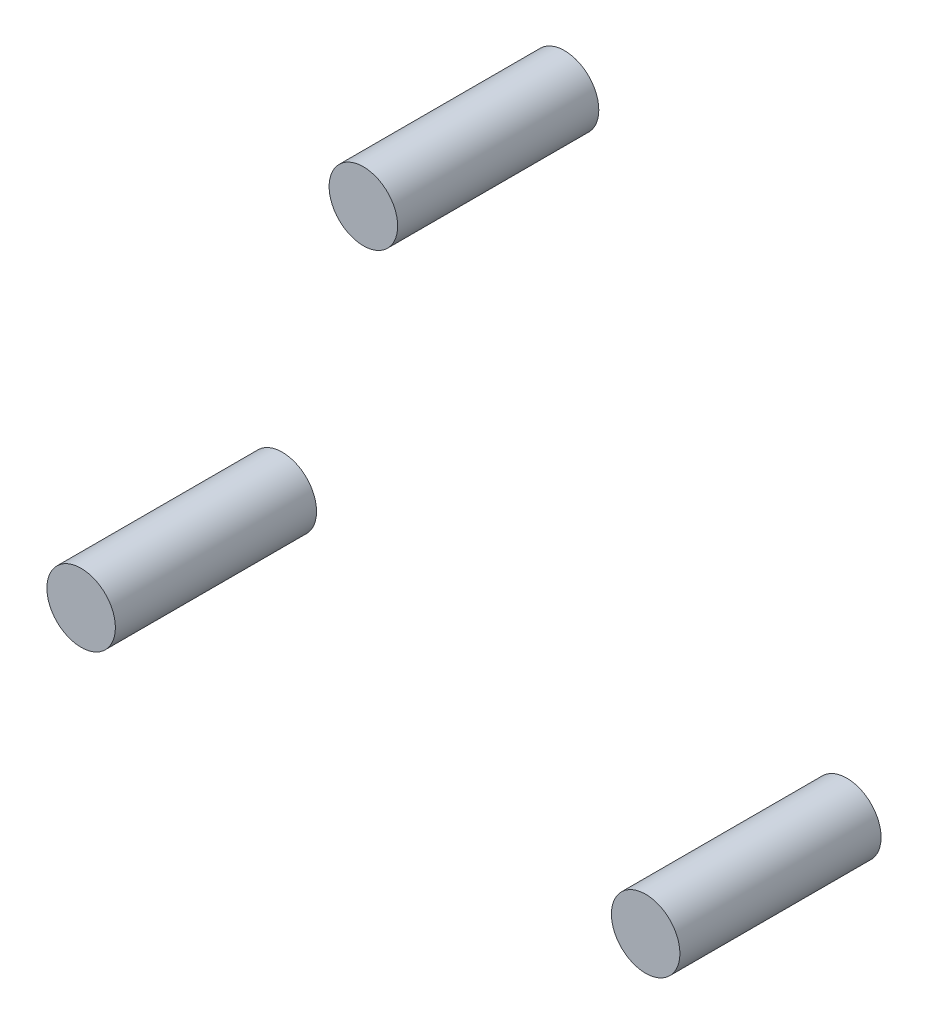
from build123d import *

# Parameters (mm, degrees)
SKETCH2_R             = 0.545
BOSS_EXTRUDE1_DEPTH   = 3.2
BOSS_EXTRUDE1_2_DEPTH = 3.2
BOSS_EXTRUDE1_3_DEPTH = 3.2


with BuildPart() as part:
    # Sketch2 → Boss-Extrude1 (new body)
    with BuildSketch(Plane.XY):
        with Locations((-4.490341719, -2.5925)):
            Circle(SKETCH2_R)
    extrude(amount=BOSS_EXTRUDE1_DEPTH)


with BuildPart() as body_2:
    # Sketch2 → Boss-Extrude1 2 (new body)
    with BuildSketch(Plane.XY):
        with Locations((0, 5.185)):
            Circle(SKETCH2_R)
    extrude(amount=BOSS_EXTRUDE1_2_DEPTH)


with BuildPart() as body_3:
    # Sketch2 → Boss-Extrude1 3 (new body)
    with BuildSketch(Plane.XY):
        with Locations((4.490341719, -2.5925)):
            Circle(SKETCH2_R)
    extrude(amount=BOSS_EXTRUDE1_3_DEPTH)


solid = Compound([part.part, body_2.part, body_3.part])
